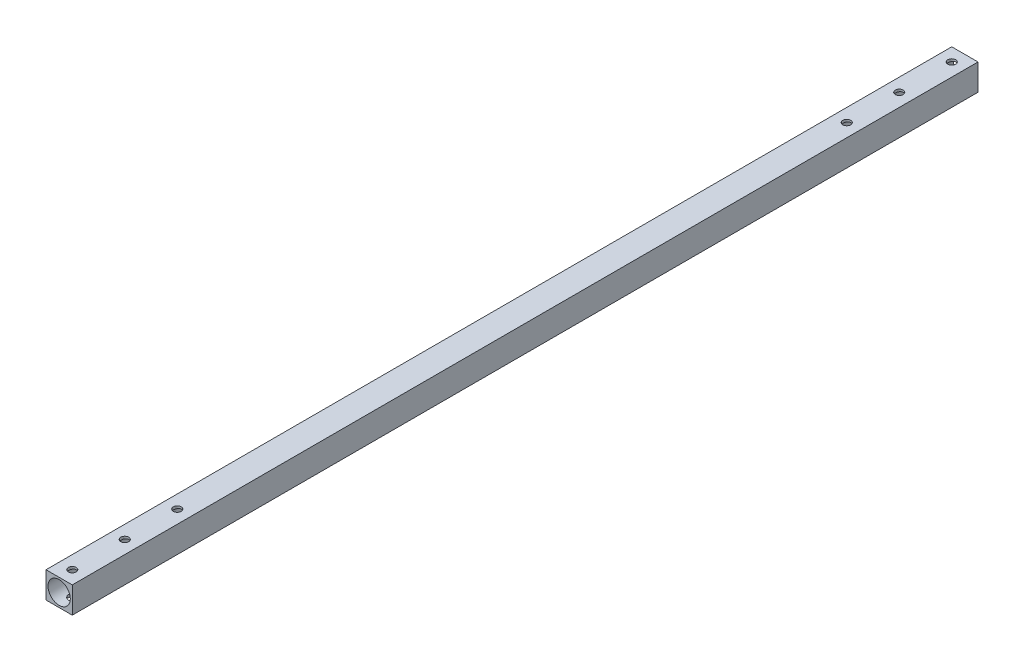
from build123d import *

# Parameters (mm, degrees)
SKETCH1_W           = 10
SKETCH1_H           = 10
SKETCH1_R           = 4.25
BOSS_EXTRUDE1_DEPTH = 345
SKETCH2_R           = 1.5
CUT_EXTRUDE1_DEPTH  = 346.181111882


with BuildPart() as part:
    # Sketch1 → Boss-Extrude1 (new body)
    with BuildSketch(Plane.XY):
        Rectangle(SKETCH1_W, SKETCH1_H)
        Circle(SKETCH1_R, mode=Mode.SUBTRACT)
    extrude(amount=BOSS_EXTRUDE1_DEPTH)

    # Sketch2 → Cut-Extrude1 (cut, through all)
    with BuildSketch(Plane(origin=(0, 5, 0), x_dir=(1, 0, 0), z_dir=(0, 1, 0))):
        with Locations(Location((0, -5, 0), (0, 0, 270))):
            Circle(SKETCH2_R)
        with Locations(Location((0, -25, 0), (0, 0, 270))):
            Circle(SKETCH2_R)
        with Locations(Location((0, -45, 0), (0, 0, 270))):
            Circle(SKETCH2_R)
        with Locations(Location((0, -340, 0), (0, 0, 270))):
            Circle(SKETCH2_R)
        with Locations(Location((0, -320, 0), (0, 0, 270))):
            Circle(SKETCH2_R)
        with Locations(Location((0, -300, 0), (0, 0, 270))):
            Circle(SKETCH2_R)
    extrude(amount=-CUT_EXTRUDE1_DEPTH, mode=Mode.SUBTRACT)


solid = part.part
